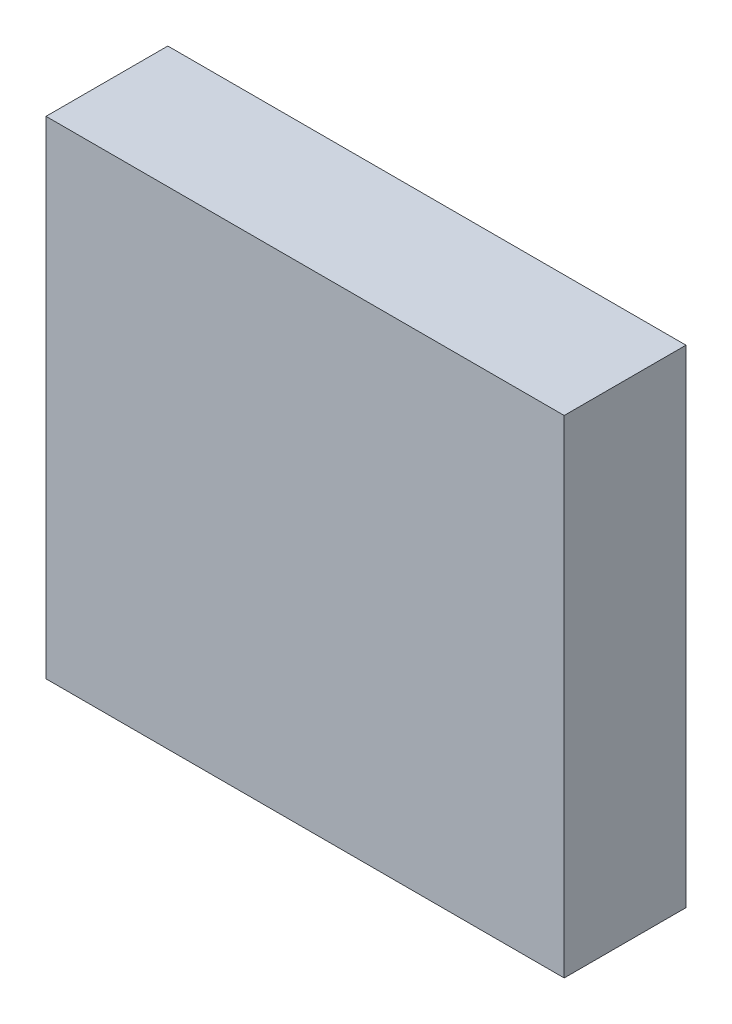
from build123d import *

# Parameters (mm, degrees)
SKETCH1_W           = 106.363185058
SKETCH1_H           = 100
BOSS_EXTRUDE1_DEPTH = 25


with BuildPart() as part:
    # Sketch1 → Boss-Extrude1 (new body)
    with BuildSketch(Plane.XY):
        Rectangle(SKETCH1_W, SKETCH1_H)
    extrude(amount=BOSS_EXTRUDE1_DEPTH)


solid = part.part
